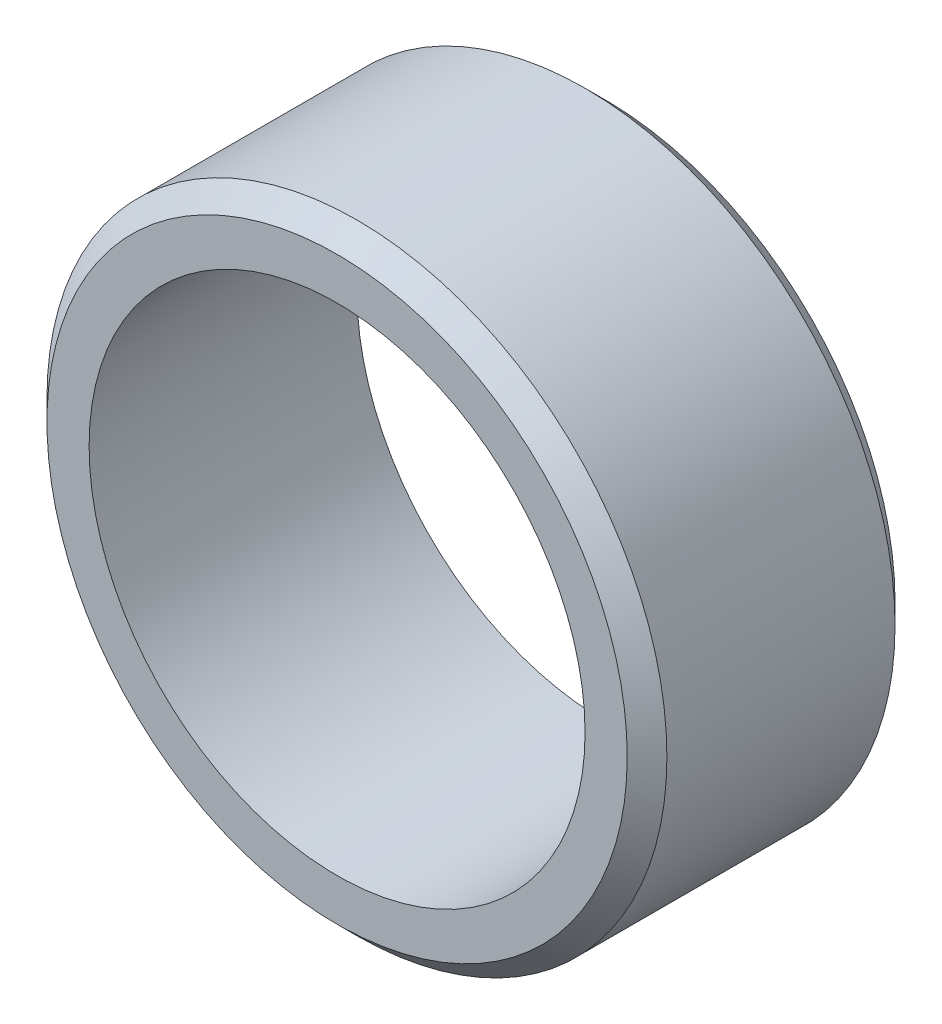
from build123d import *

# Parameters (mm, degrees)
SKETCH1_R           = 7.9375
SKETCH1_R_2         = 6.35
BOSS_EXTRUDE1_DEPTH = 6.858
CHAMFER1_SIZE       = 0.508


with BuildPart() as part:
    # Sketch1 → Boss-Extrude1 (new body)
    with BuildSketch(Plane.XY):
        Circle(SKETCH1_R)
        Circle(SKETCH1_R_2, mode=Mode.SUBTRACT)
    extrude(amount=BOSS_EXTRUDE1_DEPTH)

    # Chamfer1
    chamfer1_edges = [part.edges().sort_by_distance(p)[0] for p in [
        (-7.9375, 0, 0),
        (-7.9375, 0, 6.858),
    ]]
    chamfer(chamfer1_edges, length=CHAMFER1_SIZE)


solid = part.part
